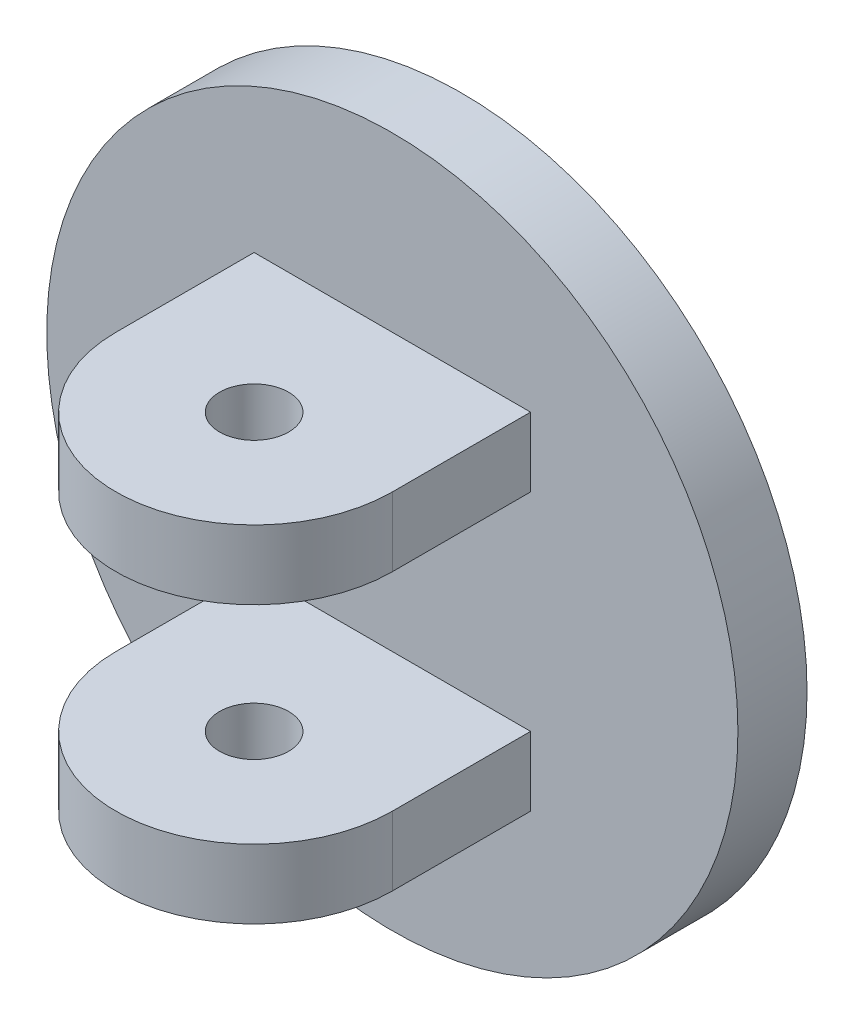
from build123d import *

# Parameters (mm, degrees)
SKETCH1_R               = 50
BOSS_EXTRUDE1_DEPTH     = 10
BOSS_EXTRUDE2_DEPTH     = 40
CUT_EXTRUDE1_DEPTH      = 10
CUT_EXTRUDE1_DEPTH_BACK = 51
SKETCH3_R               = 5
CUT_EXTRUDE3_DEPTH      = 51
CUT_EXTRUDE3_DEPTH_BACK = 51


with BuildPart() as part:
    # Sketch1 → Boss-Extrude1 (new body)
    with BuildSketch(Plane.XY):
        Circle(SKETCH1_R)
    extrude(amount=BOSS_EXTRUDE1_DEPTH)

    # Sketch2 → Boss-Extrude2 (add)
    with BuildSketch(Plane.XY.offset(10)):
        Polygon((0, 15), (20, 15), (20, 25), (0, 25), (-20, 25), (-20, 15), align=None)
        Polygon((0, -15), (20, -15), (20, -25), (0, -25), (-20, -25), (-20, -15), align=None)
    extrude(amount=BOSS_EXTRUDE2_DEPTH)

    # Sketch3 → Cut-Extrude1 (cut, two sides: drawn at the far end of the back side and taken through both)
    with BuildSketch(Plane(origin=(0, 25, 0), x_dir=(1, 0, 0), z_dir=(0, 1, 0)).offset(-CUT_EXTRUDE1_DEPTH_BACK)):
        with Locations((0, -30)):
            Circle(SKETCH3_R)
    extrude(amount=CUT_EXTRUDE1_DEPTH + CUT_EXTRUDE1_DEPTH_BACK, mode=Mode.SUBTRACT)

    # Sketch4 → Cut-Extrude3 (cut, two sides: drawn at the far end of the back side and taken through both)
    with BuildSketch(Plane.XZ.offset(25).offset(-CUT_EXTRUDE3_DEPTH_BACK)):
        with BuildLine():
            Line((-20, 30), (-47.366486711, 30))
            Line((-47.366486711, 30), (-38.964183934, 74.74544014))
            Line((-38.964183934, 74.74544014), (40.839267743, 70.572196031))
            Line((40.839267743, 70.572196031), (55.137019974, 30))
            Line((55.137019974, 30), (20, 30))
            ThreePointArc((20, 30), (0, 50), (-20, 30))
        make_face()
    extrude(amount=CUT_EXTRUDE3_DEPTH + CUT_EXTRUDE3_DEPTH_BACK, mode=Mode.SUBTRACT)


solid = part.part
